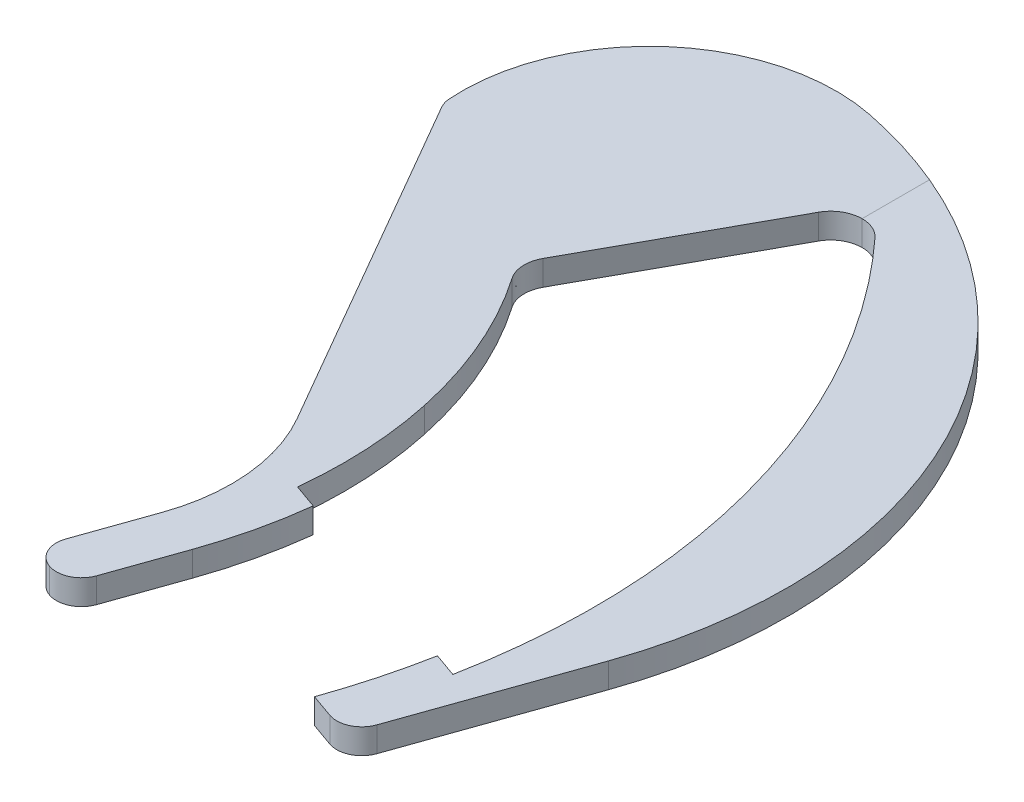
from build123d import *

# Parameters (mm, degrees)
BOSS_EXTRUDE1_DEPTH    = 6.35
CUT_EXTRUDE1_DEPTH     = 218.474824132
CUT_EXTRUDE2_DEPTH     = 218.474824132
BOSS_EXTRUDE2_DEPTH    = 6.35
FILLET1_R              = 6.35
SPLIT1_SURFACE_1_BACK  = 255.18
SPLIT1_SURFACE_1_DEPTH = 510.36
SPLIT1_SURFACE_2_BACK  = 255.18
SPLIT1_SURFACE_2_DEPTH = 510.36


with BuildPart() as part:
    # Sketch1 → Boss-Extrude1 (new body)
    with BuildSketch(Plane(origin=(0, 0, 0), x_dir=(1, 0, 0), z_dir=(0, 1, 0))):
        with BuildLine():
            Line((-47.453228006, 53.404284402), (-98.253228006, 141.392465427))
            ThreePointArc((-98.253228006, 141.392465427), (-82.921975522, 181.453316928), (-41.566473575, 192.839342769))
            ThreePointArc((-41.566473575, 192.839342769), (36.836225704, 136.004392842), (45.380299153, 39.546144899))
            Line((45.380299153, 39.546144899), (27.944541838, -9.861512816))
            Line((27.944541838, -9.861512816), (0, 0))
            Line((0, 0), (-43.950457827, 15.509934128))
            ThreePointArc((-43.950457827, 15.509934128), (-41.550098289, 34.840876427), (-47.453228006, 53.404284402))
        make_face()
    extrude(amount=BOSS_EXTRUDE1_DEPTH)

    # Sketch5 → Cut-Extrude1 (cut, through all)
    with BuildSketch(Plane(origin=(0, 6.35, 0), x_dir=(1, 0, 0), z_dir=(0, 1, 0))):
        with BuildLine():
            Line((-29.23664893, 81.427581144), (15.574383155, 98.792652007))
            ThreePointArc((15.574383155, 98.792652007), (22.053436092, 98.460407789), (26.120098061, 93.405630482))
            ThreePointArc((26.120098061, 93.405630482), (31.67419382, 55.261505814), (28.616328902, 16.836622098))
            Line((28.616328902, 16.836622098), (22.559524164, 18.974043348))
            ThreePointArc((22.559524164, 18.974043348), (19.726825076, 6.545871538), (15.949337201, -5.628454892))
            Line((15.949337201, -5.628454892), (-31.95525319, 11.276876204))
            ThreePointArc((-31.95525319, 11.276876204), (-28.372538305, 23.563648828), (-26.173781301, 36.171824553))
            Line((-26.173781301, 36.171824553), (-32.322028113, 38.341515332))
            ThreePointArc((-32.322028113, 38.341515332), (-31.887912186, 55.427050363), (-34.131380562, 72.370214577))
            ThreePointArc((-34.131380562, 72.370214577), (-33.353370645, 77.801041885), (-29.23664893, 81.427581144))
        make_face()
    extrude(amount=-CUT_EXTRUDE1_DEPTH, mode=Mode.SUBTRACT)

    # Sketch6 → Cut-Extrude2 (cut, through all)
    with BuildSketch(Plane(origin=(0, 6.35, 0), x_dir=(1, 0, 0), z_dir=(0, 1, 0))):
        with BuildLine():
            Line((-34.136031583, 72.371811773), (26.116293886, 93.401758977))
            add(Edge.make_bspline(
                [(26.116293886, 93.401758977), (24.324889601, 100.23803776), (22.130168151, 106.901258397), (16.96212823, 119.893613822), (13.988046064, 126.222420918), (9.776956475, 133.921680991), (8.910007749, 135.450921337), (7.126151123, 138.487965199), (6.207974968, 139.997768114), (3.386426272, 144.480432789), (1.42392697, 147.394611788), (-4.701484626, 155.920269738), (-9.100754748, 161.316287945), (-13.809441186, 166.430246232)],
                knots=[0, 0, 0, 0, 0.25, 0.25, 0.5, 0.5, 0.5625, 0.5625, 0.625, 0.625, 0.75, 0.75, 1, 1, 1, 1], degree=3))
            add(Edge.make_bspline(
                [(-26.604572492, 164.8773905), (-26.150591479, 165.703254328), (-25.515446259, 166.400295605), (-24.879031904, 167.098729697), (-24.095373437, 167.628794259), (-23.313760397, 168.1574753), (-22.428907317, 168.488425961), (-21.547481327, 168.818094831), (-20.612298709, 168.932538075), (-19.674896196, 169.047252981), (-18.735576663, 168.938540794), (-17.797334242, 168.829953267), (-16.909699728, 168.503685222), (-16.026331795, 168.178985445), (-15.242553256, 167.655985099), (-14.452846951, 167.129029268), (-13.809441186, 166.430246232)],
                knots=[0, 0, 0, 0.125, 0.125, 0.25, 0.25, 0.375, 0.375, 0.5, 0.5, 0.625, 0.625, 0.75, 0.75, 0.875, 0.875, 1, 1, 1], degree=2))
            Line((-26.604572492, 164.8773905), (-51.39264493, 119.783935416))
            add(Edge.make_bspline(
                [(-50.971516495, 111.453693883), (-51.597295758, 112.361285599), (-51.952278538, 113.405618938), (-52.307499269, 114.450652309), (-52.364051333, 115.554155451), (-52.420577964, 116.657162304), (-52.173441916, 117.734834771), (-51.926064332, 118.813560494), (-51.39264493, 119.783935416)],
                knots=[0, 0, 0, 0.25, 0.25, 0.5, 0.5, 0.75, 0.75, 1, 1, 1], degree=2))
            add(Edge.make_bspline(
                [(-50.971516495, 111.453693883), (-48.958817602, 108.534599247), (-47.092599274, 105.523689489), (-43.653878745, 99.317766492), (-42.08164257, 96.122586505), (-39.950407344, 91.187456603), (-39.27814351, 89.518531936), (-38.021441634, 86.160956199), (-37.435479748, 84.468826365), (-36.34793939, 81.058006993), (-35.846327383, 79.339328012), (-34.927561091, 75.875386956), (-34.510190541, 74.129079907), (-34.136031583, 72.371811773)],
                knots=[0, 0, 0, 0, 0.25, 0.25, 0.5, 0.5, 0.625, 0.625, 0.75, 0.75, 0.875, 0.875, 1, 1, 1, 1], degree=3))
        make_face()
    extrude(amount=-CUT_EXTRUDE2_DEPTH, mode=Mode.SUBTRACT)

    # Sketch7 → Boss-Extrude2 (add)
    with BuildSketch(Plane(origin=(0, 0, 0), x_dir=(1, 0, 0), z_dir=(0, 1, 0))):
        Polygon((-43.950457827, 15.509934128), (-52.403123375, -8.442361068), (-40.408086707, -12.675359716), (-31.95525319, 11.276876204), align=None)
    extrude(amount=BOSS_EXTRUDE2_DEPTH)

    # Fillet1
    fillet1_edges = [part.edges().sort_by_distance(p)[0] for p in [
        (-98.253228006, 3.175, -141.392465427),
        (27.944541838, 3.175, 9.861512816),
        (-52.403123375, 3.175, 8.442361068),
        (-40.408086707, 3.175, 12.675359716),
    ]]
    fillet(fillet1_edges, radius=FILLET1_R)


with BuildPart() as body_2:
    # Split1: the piece behind the surface
    add(part.part)
    # Split1 surface: a surface, the sketch's curves swept straight by 510.36 mm
    with BuildLine(Plane(origin=(0, 6.35, 0), x_dir=(1, 0, 0), z_dir=(0, 1, 0)).offset(-SPLIT1_SURFACE_1_BACK), mode=Mode.PRIVATE) as split1_surface_1_path:
        Line((-19.649206058, 186.1076897), (-19.649206058, 168.991436526))
    split1_surface_1 = Shell.extrude(split1_surface_1_path.wire(), (0 * SPLIT1_SURFACE_1_DEPTH, 1 * SPLIT1_SURFACE_1_DEPTH, 0 * SPLIT1_SURFACE_1_DEPTH))
    split(bisect_by=split1_surface_1, keep=Keep.BOTTOM)


with BuildPart() as part_1:
    add(part.part)

    # Split1: split by a surface, the side it looks to stays
    # Split1 surface: a surface, the sketch's curves swept straight by 510.36 mm
    with BuildLine(Plane(origin=(0, 6.35, 0), x_dir=(1, 0, 0), z_dir=(0, 1, 0)).offset(-SPLIT1_SURFACE_2_BACK), mode=Mode.PRIVATE) as split1_surface_2_path:
        Line((-19.649206058, 186.1076897), (-19.649206058, 168.991436526))
    split1_surface_2 = Shell.extrude(split1_surface_2_path.wire(), (0 * SPLIT1_SURFACE_2_DEPTH, 1 * SPLIT1_SURFACE_2_DEPTH, 0 * SPLIT1_SURFACE_2_DEPTH))
    split(bisect_by=split1_surface_2, keep=Keep.TOP)


solid = Compound([body_2.part, part_1.part])
